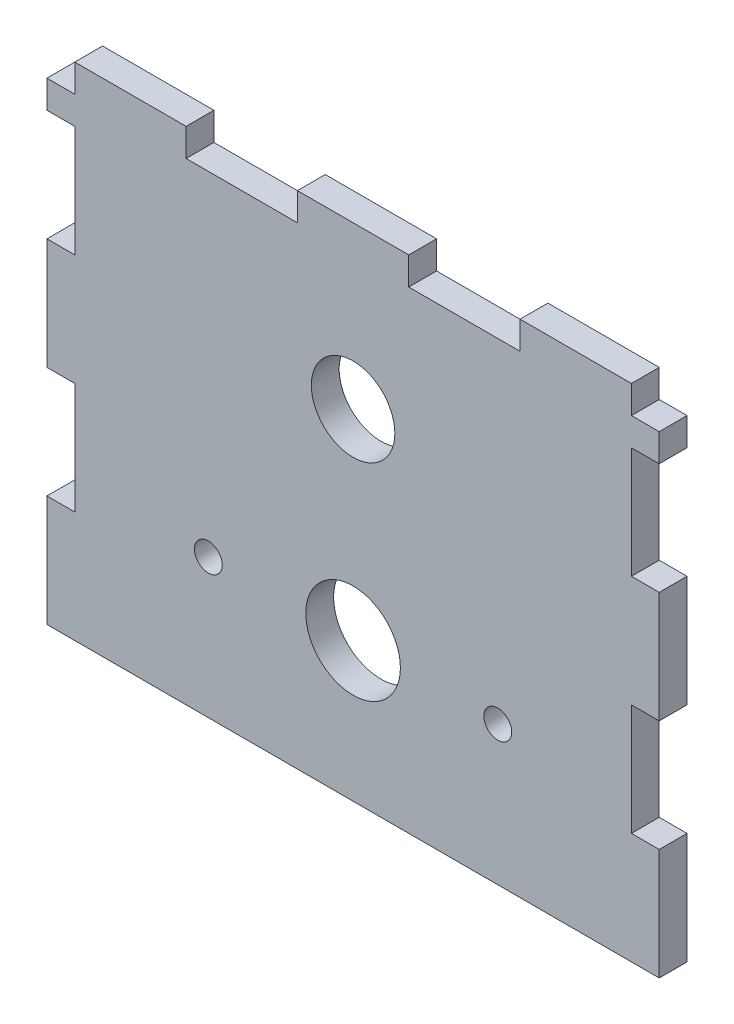
from build123d import *

# Parameters (mm, degrees)
SKETCH_1_W                       = 100
SKETCH_1_H                       = 85
SKETCH_1_R                       = 8.5
SKETCH_1_R_2                     = 2.5
SKETCH_1_R_3                     = 7.5
EXTRUDE_1_DEPTH                  = 5
SKETCH_2_W                       = 5
SKETCH_2_H                       = 20
EXTRUDE_2_DEPTH                  = 5
PATTERN_LINEAR_1_COUNT           = 2
PATTERN_LINEAR_1_PITCH           = 40
PATTERN_LINEAR_1_COPY_1_SKETCH_W = 5
PATTERN_LINEAR_1_COPY_1_SKETCH_H = 20
PATTERN_LINEAR_1_COPY_1_DEPTH    = 5
SKETCH_3_W                       = 20
SKETCH_3_H                       = 5
EXTRUDE_3_DEPTH                  = 5
PATTERN_LINEAR_2_COUNT           = 2
PATTERN_LINEAR_2_PITCH           = 40
PATTERN_LINEAR_3_COUNT           = 2
PATTERN_LINEAR_3_PITCH           = 40
SKETCH_5_W                       = 5
SKETCH_5_H                       = 5
EXTRUDE_4_DEPTH                  = 5


with BuildPart() as part:
    # 스케치1 → 보스-돌출1 (new body)
    with BuildSketch(Plane.XY):
        Rectangle(SKETCH_1_W, SKETCH_1_H)
        with Locations((0, -17.5)):
            Circle(SKETCH_1_R, mode=Mode.SUBTRACT)
        with Locations((-26, -17.5)):
            Circle(SKETCH_1_R_2, mode=Mode.SUBTRACT)
        with Locations((26, -17.5)):
            Circle(SKETCH_1_R_2, mode=Mode.SUBTRACT)
        with Locations((0, 18.5)):
            Circle(SKETCH_1_R_3, mode=Mode.SUBTRACT)
    extrude(amount=EXTRUDE_1_DEPTH)

    # 스케치2 → 보스-돌출2 (add)
    with BuildSketch(Plane.XY.offset(5)):
        with Locations((52.5, -32.5)):
            Rectangle(SKETCH_2_W, SKETCH_2_H)
    extrude_2 = extrude(amount=-EXTRUDE_2_DEPTH)

    # 대칭 복사1: 보스-돌출2 across plane
    add(extrude_2.mirror(Plane(origin=(0, 0, 0), x_dir=(0, 0, 1), z_dir=(1, 0, 0))))

    # 선형 패턴1: 보스-돌출2 ×2
    with Locations(*[(0, i * PATTERN_LINEAR_1_PITCH, 0) for i in range(1, PATTERN_LINEAR_1_COUNT)]):
        add(extrude_2)

    # 선형 패턴1 copy 1 sketch → 선형 패턴1 copy 1 (add)
    with BuildSketch(Plane(origin=(0, 40, 5), x_dir=(-1, 0, 0), z_dir=(0, 0, 1))):
        with Locations((52.5, 32.5)):
            Rectangle(PATTERN_LINEAR_1_COPY_1_SKETCH_W, PATTERN_LINEAR_1_COPY_1_SKETCH_H)
    extrude(amount=-PATTERN_LINEAR_1_COPY_1_DEPTH)

    # 스케치3 → 보스-돌출3 (add)
    with BuildSketch(Plane.XY.offset(5)):
        with Locations((0, 45)):
            Rectangle(SKETCH_3_W, SKETCH_3_H)
    extrude_3 = extrude(amount=-EXTRUDE_3_DEPTH)

    # 선형 패턴2: 보스-돌출3 ×2
    with Locations(*[(i * PATTERN_LINEAR_2_PITCH, 0, 0) for i in range(1, PATTERN_LINEAR_2_COUNT)]):
        add(extrude_3)

    # 선형 패턴3: 보스-돌출3 ×2
    with Locations(*[(-i * PATTERN_LINEAR_3_PITCH, 0, 0) for i in range(1, PATTERN_LINEAR_3_COUNT)]):
        add(extrude_3)

    # 스케치5 → 보스-돌출4 (add)
    with BuildSketch(Plane.XY.offset(5)):
        with Locations((52.5, 40)):
            Rectangle(SKETCH_5_W, SKETCH_5_H)
    extrude_4 = extrude(amount=-EXTRUDE_4_DEPTH)

    # 대칭 복사2: 보스-돌출4 across plane
    add(extrude_4.mirror(Plane(origin=(0, 0, 0), x_dir=(0, 0, 1), z_dir=(1, 0, 0))))


solid = part.part
